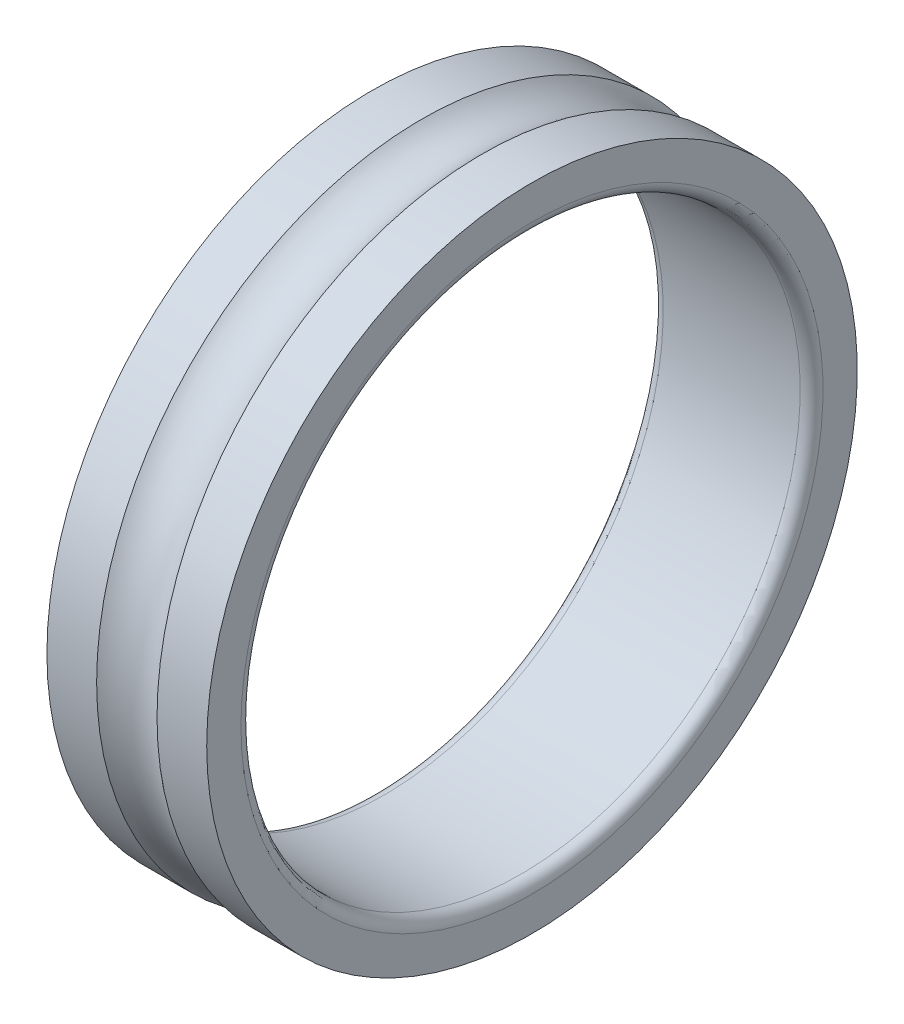
from build123d import *


with BuildPart() as part:
    # Esquisse1 → Base-Révolution (revolve)
    with BuildSketch(Plane.XY):
        with BuildLine():
            Line((-4.285714286, 17.5), (4.285714286, 17.5))
            ThreePointArc((4.285714286, 17.5), (4.790790558, 17.709209442), (5, 18.214285714))
            Line((5, 18.214285714), (5, 20.357142857))
            Line((5, 20.357142857), (1.889822365, 20.357142857))
            ThreePointArc((1.889822365, 20.357142857), (0, 19.642857143), (-1.889822365, 20.357142857))
            Line((-1.889822365, 20.357142857), (-5, 20.357142857))
            Line((-5, 20.357142857), (-5, 18.214285714))
            ThreePointArc((-5, 18.214285714), (-4.790790558, 17.709209442), (-4.285714286, 17.5))
        make_face()
    revolve(axis=Axis((0, 0, 0), (1, 0, 0)))


solid = part.part
